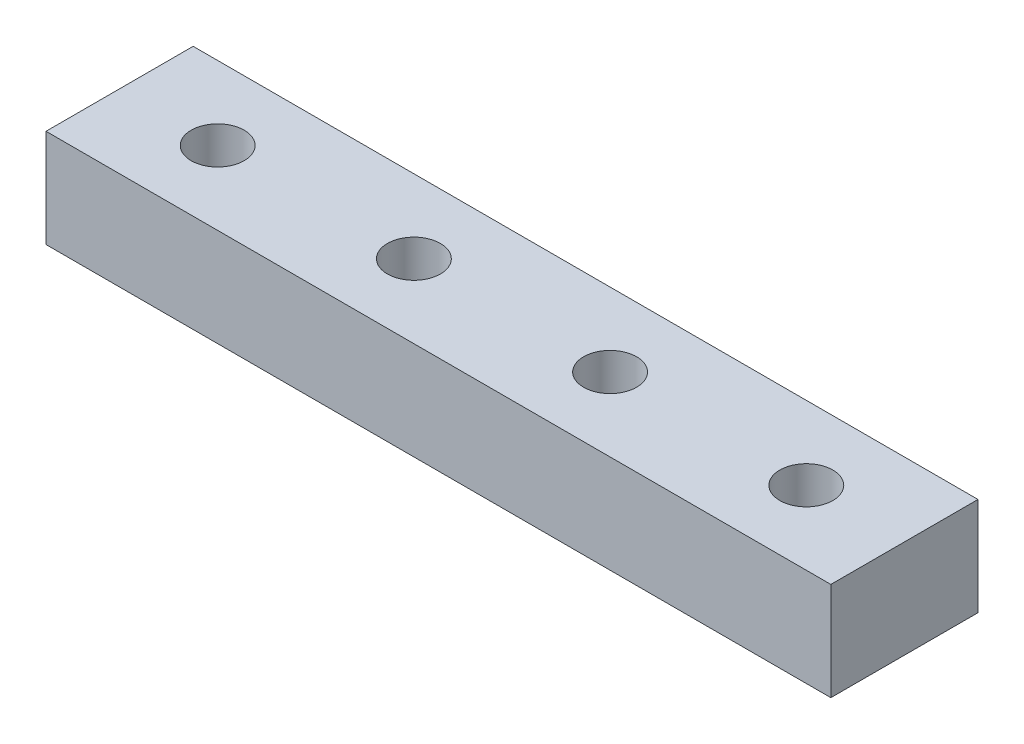
from build123d import *

# Parameters (mm, degrees)
SKETCH1_W           = 101.6
SKETCH1_H           = 19.05
BOSS_EXTRUDE1_DEPTH = 12.7
SKETCH2_R           = 3.429
CUT_EXTRUDE1_DEPTH  = 56.72102386
SKETCH3_R           = 6.604
CUT_EXTRUDE4_DEPTH  = 6.985


with BuildPart() as part:
    # Sketch1 → Boss-Extrude1 (new body)
    with BuildSketch(Plane(origin=(0, 0, 0), x_dir=(1, 0, 0), z_dir=(0, 1, 0))):
        with Locations((0, 9.525)):
            Rectangle(SKETCH1_W, SKETCH1_H)
    extrude(amount=BOSS_EXTRUDE1_DEPTH)

    # Sketch2 → Cut-Extrude1 (cut, through all)
    with BuildSketch(Plane(origin=(0, 12.7, 0), x_dir=(1, 0, 0), z_dir=(0, 1, 0))):
        with Locations(Location((-38.1, 9.525, 0), (0, 0, 270))):
            Circle(SKETCH2_R)
        with Locations(Location((38.1, 9.525, 0), (0, 0, 270))):
            Circle(SKETCH2_R)
        with Locations(Location((-12.7, 9.525, 0), (0, 0, 270))):
            Circle(SKETCH2_R)
        with Locations(Location((12.7, 9.525, 0), (0, 0, 270))):
            Circle(SKETCH2_R)
    extrude(amount=-CUT_EXTRUDE1_DEPTH, mode=Mode.SUBTRACT)

    # Sketch3 → Cut-Extrude4 (cut)
    with BuildSketch(Plane(origin=(0, 0, 0), x_dir=(1, 0, 0), z_dir=(0, 1, 0))):
        with Locations(Location((-12.7, 9.525, 0), (0, 0, 270))):
            Circle(SKETCH3_R)
        with Locations(Location((12.7, 9.525, 0), (0, 0, 270))):
            Circle(SKETCH3_R)
    extrude(amount=CUT_EXTRUDE4_DEPTH, mode=Mode.SUBTRACT)


solid = part.part
